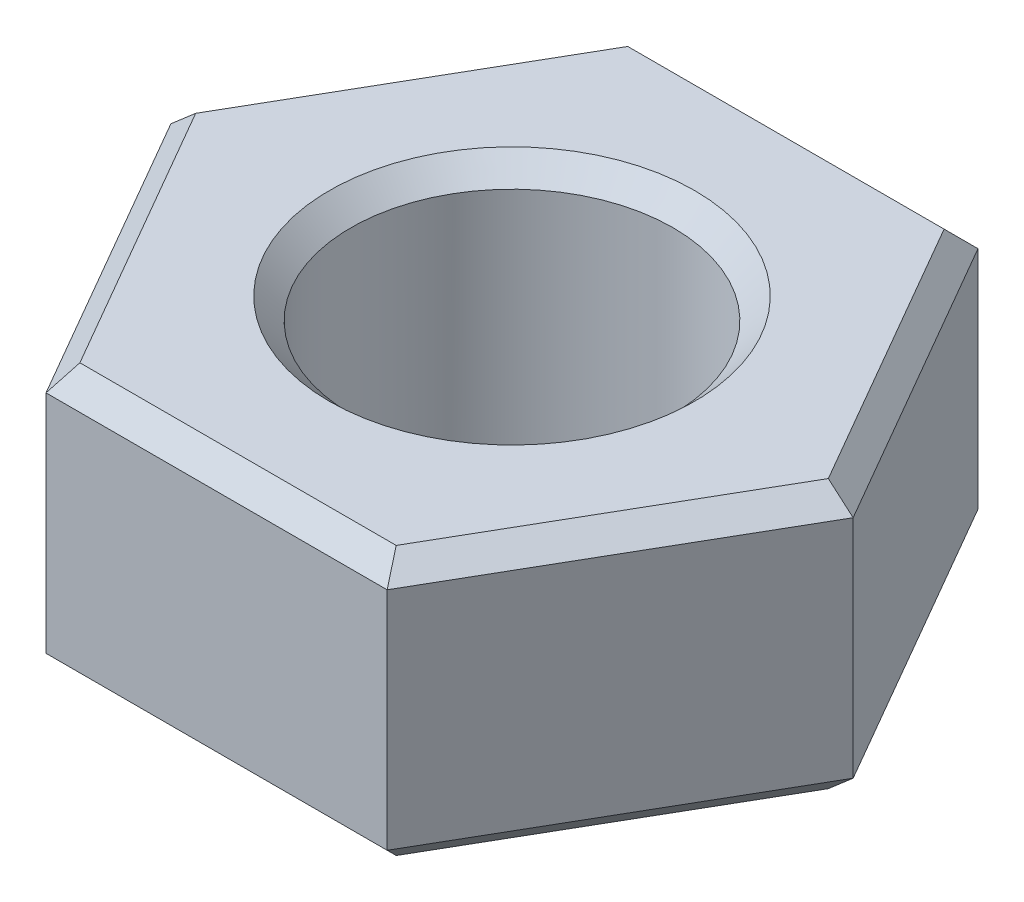
from build123d import *

# Parameters (mm, degrees)
SKETCH1_R           = 1.5
BOSS_EXTRUDE1_DEPTH = 2.5
CHAMFER1_SIZE       = 0.2


with BuildPart() as part:
    # Sketch1 → Boss-Extrude1 (new body)
    with BuildSketch(Plane(origin=(0, 0, 0), x_dir=(1, 0, 0), z_dir=(0, 1, 0))):
        Polygon((3.175426481, 0), (1.58771324, 2.75), (-1.58771324, 2.75), (-3.175426481, 0), (-1.58771324, -2.75), (1.58771324, -2.75), align=None)
        with Locations(Location((0, 0, 0), (0, 0, 270))):
            Circle(SKETCH1_R, mode=Mode.SUBTRACT)
    extrude(amount=BOSS_EXTRUDE1_DEPTH)

    # Chamfer1
    chamfer1_edges = [part.edges().sort_by_distance(p)[0] for p in [
        (0, 2.5, -2.75),
        (-2.38156986, 2.5, -1.375),
        (-2.38156986, 2.5, 1.375),
        (0, 0, -1.5),
        (0, 2.5, -1.5),
        (0, 2.5, 2.75),
        (2.38156986, 2.5, 1.375),
        (0, 0, 2.75),
        (-2.38156986, 0, 1.375),
        (-2.38156986, 0, -1.375),
        (2.38156986, 2.5, -1.375),
        (0, 0, -2.75),
        (2.38156986, 0, -1.375),
        (2.38156986, 0, 1.375),
    ]]
    chamfer(chamfer1_edges, length=CHAMFER1_SIZE)


solid = part.part
